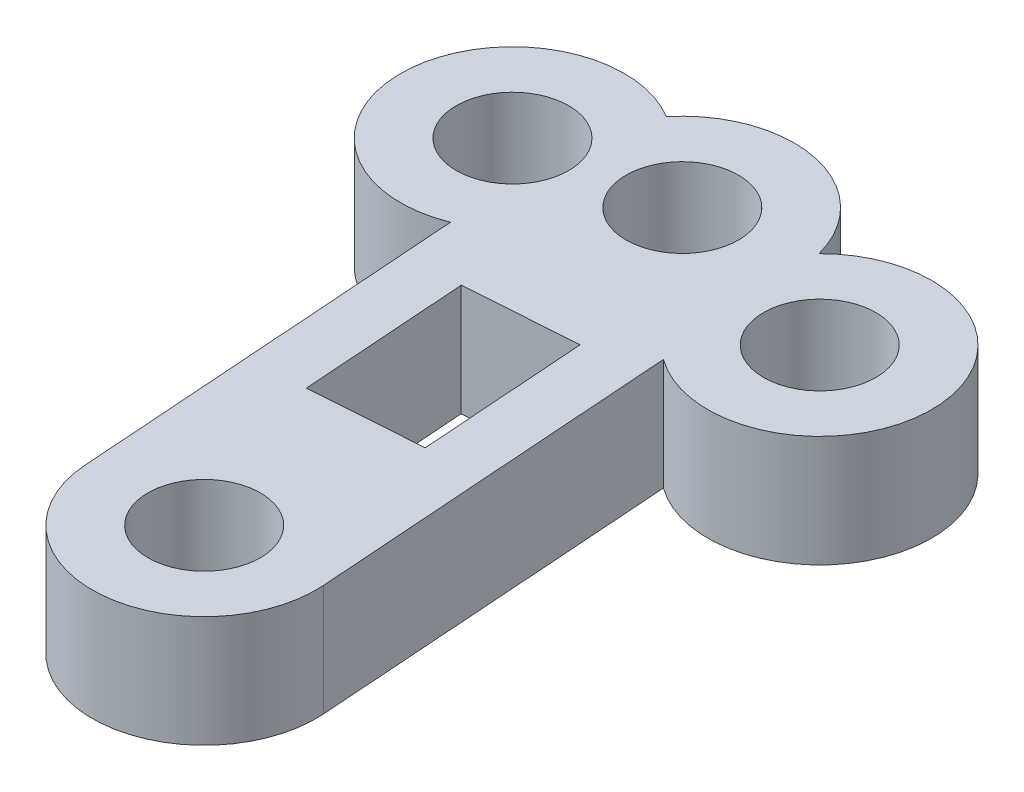
from build123d import *

# Parameters (mm, degrees)
SKETCH1_R           = 5.05
BOSS_EXTRUDE1_DEPTH = 10
CUT_EXTRUDE1_DEPTH  = 10


with BuildPart() as part:
    # Sketch1 → Boss-Extrude1 (new body)
    with BuildSketch(Plane(origin=(0, 0, 0), x_dir=(1, 0, 0), z_dir=(0, 1, 0))):
        with BuildLine():
            Line((13.338907001, -11.489526472), (11.034706991, 21.319990694))
            ThreePointArc((11.034706991, 21.319990694), (26.944443341, 30.280165305), (9.790047406, 36.535654086))
            ThreePointArc((9.790047406, 36.535654086), (2.201013528, 43.799487348), (-7.715302177, 40.332011077))
            ThreePointArc((-7.715302177, 40.332011077), (-22.969610395, 32.582266479), (-9.193128161, 22.435296597))
            Line((-9.193128161, 22.435296597), (-6.711707001, -12.897673528))
            ThreePointArc((-6.711707001, -12.897673528), (4.017673528, -22.218907001), (13.338907001, -11.489526472))
        make_face()
        with Locations(Location((3.3136, -12.1936, 0), (0, 0, 270))):
            Circle(SKETCH1_R, mode=Mode.SUBTRACT)
        with Locations(Location((-12.9537, 31.7552, 0), (0, 0, 270))):
            Circle(SKETCH1_R, mode=Mode.SUBTRACT)
        with Locations(Location((0.071, 33.9778, 0), (0, 0, 270))):
            Circle(SKETCH1_R, mode=Mode.SUBTRACT)
        with Locations(Location((16.9279, 29.4608, 0), (0, 0, 270))):
            Circle(SKETCH1_R, mode=Mode.SUBTRACT)
    extrude(amount=BOSS_EXTRUDE1_DEPTH)

    # Sketch2 → Cut-Extrude1 (cut)
    with BuildSketch(Plane(origin=(0, 10, 0), x_dir=(1, 0, 0), z_dir=(0, 1, 0))):
        Polygon((-3.820842932, 18.023387052), (6.15458692, 18.723957726), (7.205442932, 3.760812948), (-2.76998692, 3.060242274), align=None)
    extrude(amount=-CUT_EXTRUDE1_DEPTH, mode=Mode.SUBTRACT)


solid = part.part
